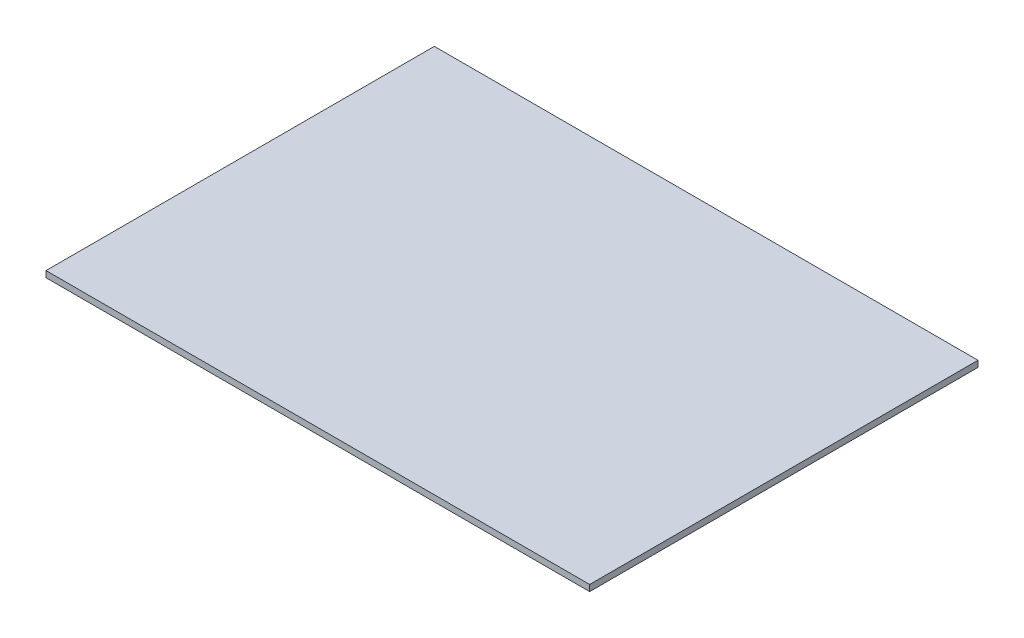
from build123d import *

# Parameters (mm, degrees)
SKETCH1_W           = 700
SKETCH1_H           = 500
BOSS_EXTRUDE1_DEPTH = 8


with BuildPart() as part:
    # Sketch1 → Boss-Extrude1 (new body)
    with BuildSketch(Plane(origin=(0, 0, 0), x_dir=(1, 0, 0), z_dir=(0, 1, 0))):
        Rectangle(SKETCH1_W, SKETCH1_H)
    extrude(amount=BOSS_EXTRUDE1_DEPTH)


solid = part.part
